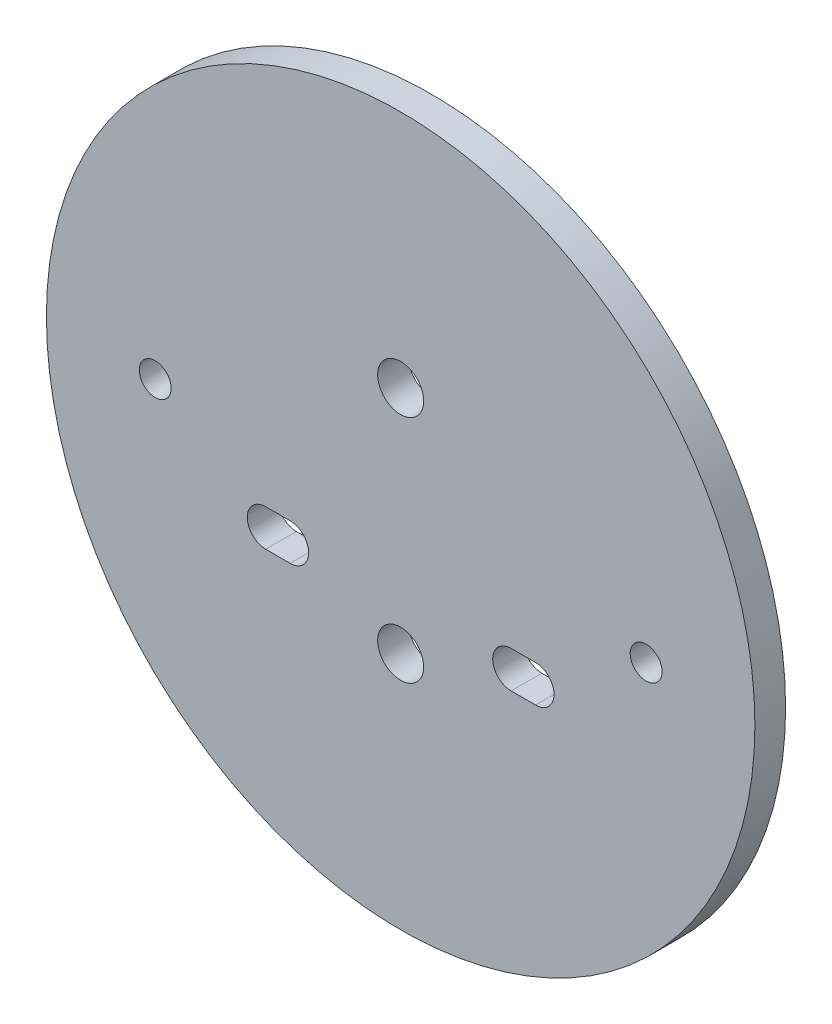
from build123d import *

# Parameters (mm, degrees)
SKETCH2_R           = 73.3171
SKETCH2_R_2         = 3.302
SKETCH2_R_3         = 4.7625
BOSS_EXTRUDE1_DEPTH = 3.175
CUT_EXTRUDE1_DEPTH  = 6.35


with BuildPart() as part:
    # Sketch2 → Boss-Extrude1 (new, symmetric)
    with BuildSketch(Plane.XY):
        Circle(SKETCH2_R)
        with Locations((-50.8, 0)):
            Circle(SKETCH2_R_2, mode=Mode.SUBTRACT)
        with Locations((50.8, 0)):
            Circle(SKETCH2_R_2, mode=Mode.SUBTRACT)
        with Locations((0, 23.8125)):
            Circle(SKETCH2_R_3, mode=Mode.SUBTRACT)
        with Locations((0, -23.8125)):
            Circle(SKETCH2_R_3, mode=Mode.SUBTRACT)
    extrude(amount=BOSS_EXTRUDE1_DEPTH, both=True)

    # Sketch3 → Cut-Extrude1 (cut)
    with BuildSketch(Plane(origin=(0, 0, -3.175), x_dir=(-1, 0, 0), z_dir=(0, 0, -1))):
        with BuildLine():
            Line((-27.94, -11.43), (-22.86, -11.43))
            ThreePointArc((-22.86, -11.43), (-19.05, -15.24), (-22.86, -19.05))
            Line((-22.86, -19.05), (-27.94, -19.05))
            ThreePointArc((-27.94, -19.05), (-31.75, -15.24), (-27.94, -11.43))
        make_face()
    cut_extrude1 = extrude(amount=-CUT_EXTRUDE1_DEPTH, mode=Mode.SUBTRACT)

    # Mirror1: Cut-Extrude1 across plane
    add(cut_extrude1.mirror(Plane(origin=(0, 0, 0), x_dir=(0, 0, 1), z_dir=(1, 0, 0))), mode=Mode.SUBTRACT)


solid = part.part
